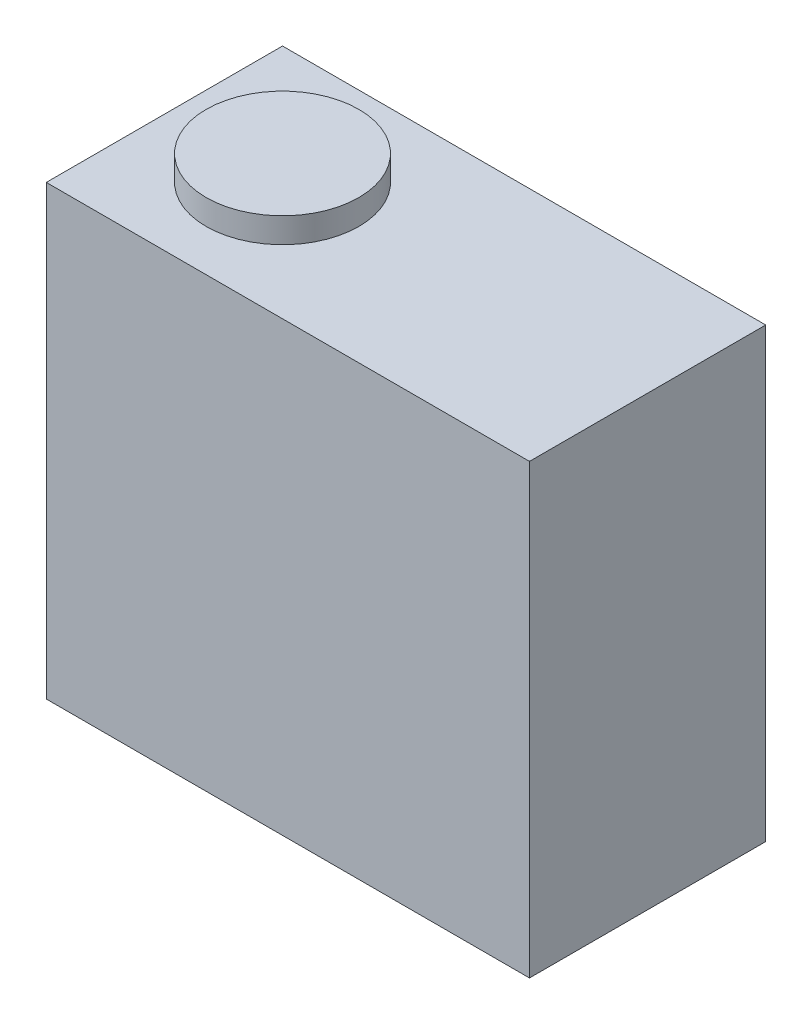
from build123d import *

# Parameters (mm, degrees)
SKETCH1_R           = 6.4
BOSS_EXTRUDE1_DEPTH = 2.1
SKETCH2_W           = 40.5
SKETCH2_H           = 19.8
BOSS_EXTRUDE2_DEPTH = 37.5


with BuildPart() as part:
    # Sketch1 → Boss-Extrude1 (new body)
    with BuildSketch(Plane(origin=(0, 0, 0), x_dir=(1, 0, 0), z_dir=(0, 1, 0))):
        Circle(SKETCH1_R)
    extrude(amount=BOSS_EXTRUDE1_DEPTH)

    # Sketch2 → Boss-Extrude2 (add)
    with BuildSketch(Plane.XZ):
        with Locations((10.35, 0)):
            Rectangle(SKETCH2_W, SKETCH2_H)
    extrude(amount=BOSS_EXTRUDE2_DEPTH)


solid = part.part
